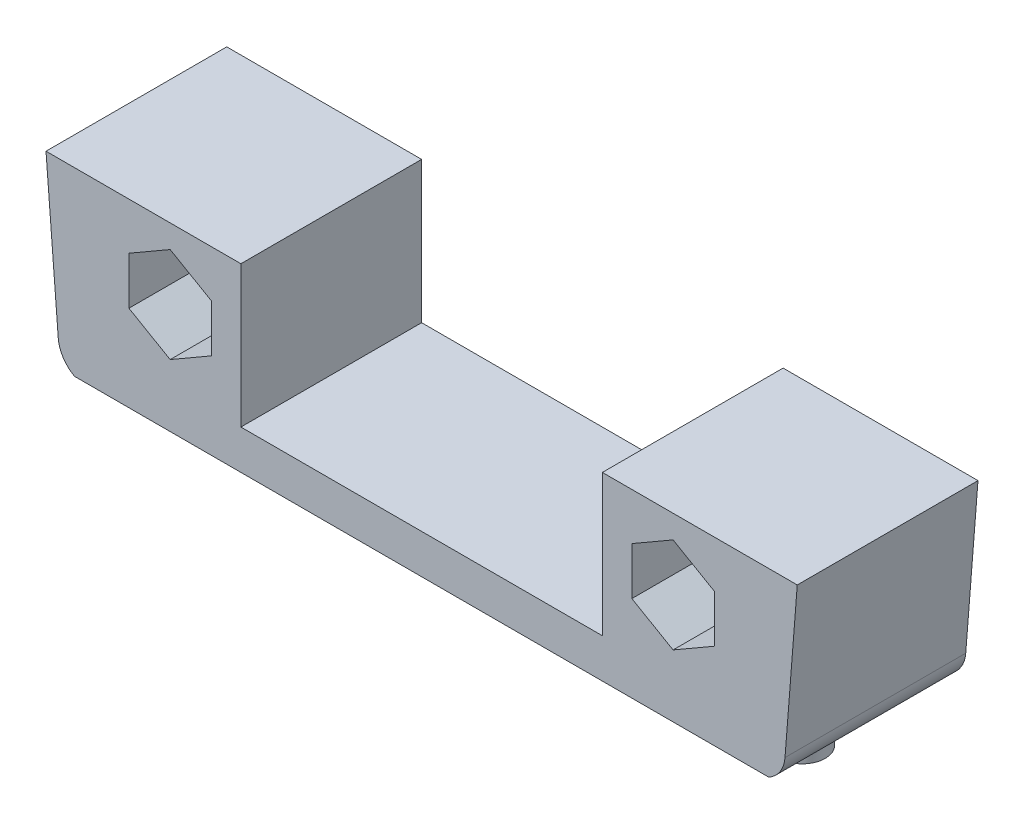
from build123d import *

# Parameters (mm, degrees)
SKETCH1_W           = 9
SKETCH1_H           = 9
BOSS_EXTRUDE1_DEPTH = 11.5
SKETCH2_W           = 45.5
SKETCH2_H           = 9.25
CUT_EXTRUDE1_DEPTH  = 4
SKETCH3_R           = 1.45
BOSS_EXTRUDE2_DEPTH = 1.8
CUT_EXTRUDE2_REACH  = 32.72
SKETCH4_W           = 3
SKETCH4_H           = 2.25


with BuildPart() as part:
    # Sketch1 → Boss-Extrude1 (new body)
    # profile 1 of 4: a face of its own
    with BuildSketch(Plane.XY):
        with BuildLine():
            Line((-20.5, -76.5), (-23.900700066, -76.5))
            Line((-23.900700066, -76.5), (-23.121499045, -86.400687699))
            ThreePointArc((-23.121499045, -86.400687699), (-22.608100633, -87.588503122), (-21.474960733, -88.213385013))
            Line((-21.474960733, -88.213385013), (0, -92))
            Line((0, -92), (21.474960733, -88.213385013))
            ThreePointArc((21.474960733, -88.213385013), (22.608100633, -87.588503122), (23.121499045, -86.400687699))
            Line((23.121499045, -86.400687699), (23.900700066, -76.5))
            Line((23.900700066, -76.5), (20.5, -76.5))
            Line((20.5, -76.5), (20.5, -85.5))
            Line((20.5, -85.5), (11.5, -85.5))
            Line((11.5, -85.5), (-11.5, -85.5))
            Line((-11.5, -85.5), (-20.5, -85.5))
            Line((-20.5, -85.5), (-20.5, -76.5))
        make_face()
    # profile 2 of 4: a face of its own
    with BuildSketch(Plane.XY):
        with BuildLine():
            Line((-20.5, -76.5), (-23.900700066, -76.5))
            Line((-23.900700066, -76.5), (-23.121499045, -86.400687699))
            ThreePointArc((-23.121499045, -86.400687699), (-22.608100633, -87.588503122), (-21.474960733, -88.213385013))
            Line((-21.474960733, -88.213385013), (0, -92))
            Line((0, -92), (21.474960733, -88.213385013))
            ThreePointArc((21.474960733, -88.213385013), (22.608100633, -87.588503122), (23.121499045, -86.400687699))
            Line((23.121499045, -86.400687699), (23.900700066, -76.5))
            Line((23.900700066, -76.5), (20.5, -76.5))
            Line((20.5, -76.5), (20.5, -85.5))
            Line((20.5, -85.5), (11.5, -85.5))
            Line((11.5, -85.5), (-11.5, -85.5))
            Line((-11.5, -85.5), (-20.5, -85.5))
            Line((-20.5, -85.5), (-20.5, -76.5))
        make_face()
    # profile 3 of 4: a face of its own
    with BuildSketch(Plane.XY):
        with Locations((16, -81)):
            Rectangle(SKETCH1_W, SKETCH1_H)
        Polygon((18.625, -82.515544457), (16, -84.031088913), (13.375, -82.515544457), (13.375, -79.484455543), (16, -77.968911087), (18.625, -79.484455543), align=None, mode=Mode.SUBTRACT)
    # profile 4 of 4: a face of its own
    with BuildSketch(Plane.XY):
        with Locations((-16, -81)):
            Rectangle(SKETCH1_W, SKETCH1_H)
        Polygon((-13.375, -82.515544457), (-16, -84.031088913), (-18.625, -82.515544457), (-18.625, -79.484455543), (-16, -77.968911087), (-13.375, -79.484455543), align=None, mode=Mode.SUBTRACT)
    extrude(amount=BOSS_EXTRUDE1_DEPTH)

    # Sketch2 → Cut-Extrude1 (cut)
    with BuildSketch(Plane(origin=(0, -92, 0), x_dir=(1, 0, 0), z_dir=(0, 1, 0))):
        with Locations((0, -6.875)):
            Rectangle(SKETCH2_W, SKETCH2_H)
    extrude(amount=CUT_EXTRUDE1_DEPTH, mode=Mode.SUBTRACT)

    # Sketch3 → Boss-Extrude2 (add)
    with BuildSketch(Plane.XZ.offset(88)):
        with Locations(Location((-19.6, 6.875, 0), (0, 0, 270))):
            Circle(SKETCH3_R)
        with Locations(Location((19.6, 6.875, 0), (0, 0, 90))):
            Circle(SKETCH3_R)
    extrude(amount=BOSS_EXTRUDE2_DEPTH)

    # Sketch4 → Cut-Extrude2 (cut, up to next)
    with BuildSketch(Plane(origin=(0, -92, 0), x_dir=(1, 0, 0), z_dir=(0, 1, 0)), mode=Mode.PRIVATE) as cut_extrude2_sk1:
        with Locations((5.78456273, -1.125)):
            Rectangle(SKETCH4_W, SKETCH4_H)
    cut_extrude2_tool1 = extrude(cut_extrude2_sk1.sketch, amount=CUT_EXTRUDE2_REACH, mode=Mode.PRIVATE) & part.part
    add(cut_extrude2_tool1.solids().sort_by_distance((5.784563, -92, 1.125))[0], mode=Mode.SUBTRACT)


solid = part.part
